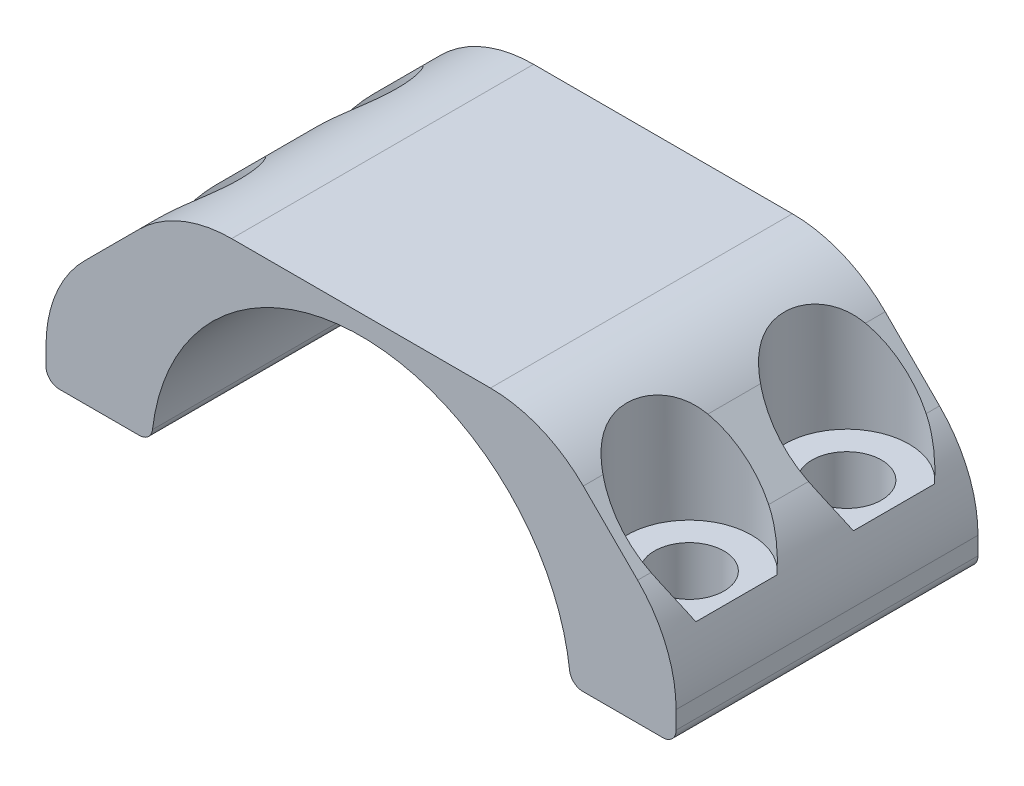
from build123d import *

# Parameters (mm, degrees)
BOSS_EXTRUDE1_DEPTH            = 11.5
CBORE_FOR_M5_SHCS1_D           = 5.3
CBORE_FOR_M5_SHCS1_CBORE_D     = 9.5
CBORE_FOR_M5_SHCS1_CBORE_DEPTH = 10
CHAMFER_2_REACH                = 39.567
SKETCH5_W                      = 48
SKETCH5_H                      = 23
CUT_EXTRUDE2_DEPTH             = 1
CUT_EXTRUDE3_DEPTH             = 38.566607513
CUT_EXTRUDE3_DEPTH_BACK        = 38.566607513
FILLET1_R                      = 1


with BuildPart() as part:
    # Sketch1 → Boss-Extrude1 (new, symmetric)
    with BuildSketch(Plane.XY):
        with BuildLine():
            Line((24, 17.5), (-24, 17.5))
            Line((-24, 17.5), (-24, 0))
            Line((-24, 0), (-16, 0))
            ThreePointArc((-16, 0), (0, 16), (16, 0))
            Line((16, 0), (24, 0))
            Line((24, 0), (24, 17.5))
        make_face()
    extrude(amount=BOSS_EXTRUDE1_DEPTH, both=True)

    # CBORE for M5 SHCS1 (through all)
    with Locations(Plane(origin=(0, 17.5, 0), x_dir=(1, 0, 0), z_dir=(0, 1, 0))):
        with Locations((-19.5, -6), (-19.5, 6), (19.5, -6), (19.5, 6)):
            CounterBoreHole(CBORE_FOR_M5_SHCS1_D / 2, CBORE_FOR_M5_SHCS1_CBORE_D / 2, CBORE_FOR_M5_SHCS1_CBORE_DEPTH)

    # Sketch4 → Chamfer 2 (cut, up to next)
    with BuildSketch(Plane.XY.offset(11.5), mode=Mode.PRIVATE) as chamfer_2_sk1:
        Polygon((24, 17.5), (14, 17.5), (24, 7.5), align=None)
    chamfer_2_tool1 = extrude(chamfer_2_sk1.sketch, amount=-CHAMFER_2_REACH, mode=Mode.PRIVATE) & part.part
    # Sketch4 → Chamfer 2 (cut, up to next)
    with BuildSketch(Plane.XY.offset(11.5), mode=Mode.PRIVATE) as chamfer_2_sk2:
        Polygon((-14, 17.5), (-24, 17.5), (-24, 7.5), align=None)
    chamfer_2_tool2 = extrude(chamfer_2_sk2.sketch, amount=-CHAMFER_2_REACH, mode=Mode.PRIVATE) & part.part
    add(chamfer_2_tool1.solids().sort_by_distance((20.666667, 14.166667, 11.5))[0], mode=Mode.SUBTRACT)
    add(chamfer_2_tool2.solids().sort_by_distance((-20.666667, 14.166667, 11.5))[0], mode=Mode.SUBTRACT)

    # Sketch5 → Cut-Extrude2 (cut)
    with BuildSketch(Plane(origin=(0, 0, 0), x_dir=(-1, 0, 0), z_dir=(0, -1, 0))):
        Rectangle(SKETCH5_W, SKETCH5_H)
    extrude(amount=-CUT_EXTRUDE2_DEPTH, mode=Mode.SUBTRACT)

    # Sketch6 → Cut-Extrude3 (cut, two sides: drawn at the far end of the back side and taken through both)
    with BuildSketch(Plane.XY.offset(11.5).offset(-CUT_EXTRUDE3_DEPTH_BACK)):
        with BuildLine():
            Line((-24, 3.357864376), (-24, 7.5))
            Line((-24, 7.5), (-21.071067812, 10.428932188))
            ThreePointArc((-21.071067812, 10.428932188), (-23.238795325, 7.1846987), (-24, 3.357864376))
        make_face()
        with BuildLine():
            Line((-16.928932188, 14.571067812), (-14, 17.5))
            Line((-14, 17.5), (-9.857864376, 17.5))
            ThreePointArc((-9.857864376, 17.5), (-13.6846987, 16.738795325), (-16.928932188, 14.571067812))
        make_face()
        with BuildLine():
            Line((9.857864376, 17.5), (14, 17.5))
            Line((14, 17.5), (16.928932188, 14.571067812))
            ThreePointArc((16.928932188, 14.571067812), (13.6846987, 16.738795325), (9.857864376, 17.5))
        make_face()
        with BuildLine():
            Line((21.071067812, 10.428932188), (24, 7.5))
            Line((24, 7.5), (24, 3.357864376))
            ThreePointArc((24, 3.357864376), (23.238795325, 7.1846987), (21.071067812, 10.428932188))
        make_face()
    extrude(amount=CUT_EXTRUDE3_DEPTH + CUT_EXTRUDE3_DEPTH_BACK, mode=Mode.SUBTRACT)

    # Fillet1
    fillet1_edges = [part.edges().sort_by_distance(p)[0] for p in [
        (-15.968719423, 1, 0),
        (15.968719423, 1, 0),
        (-24, 1, 0),
        (24, 1, 0),
    ]]
    fillet(fillet1_edges, radius=FILLET1_R)


solid = part.part
